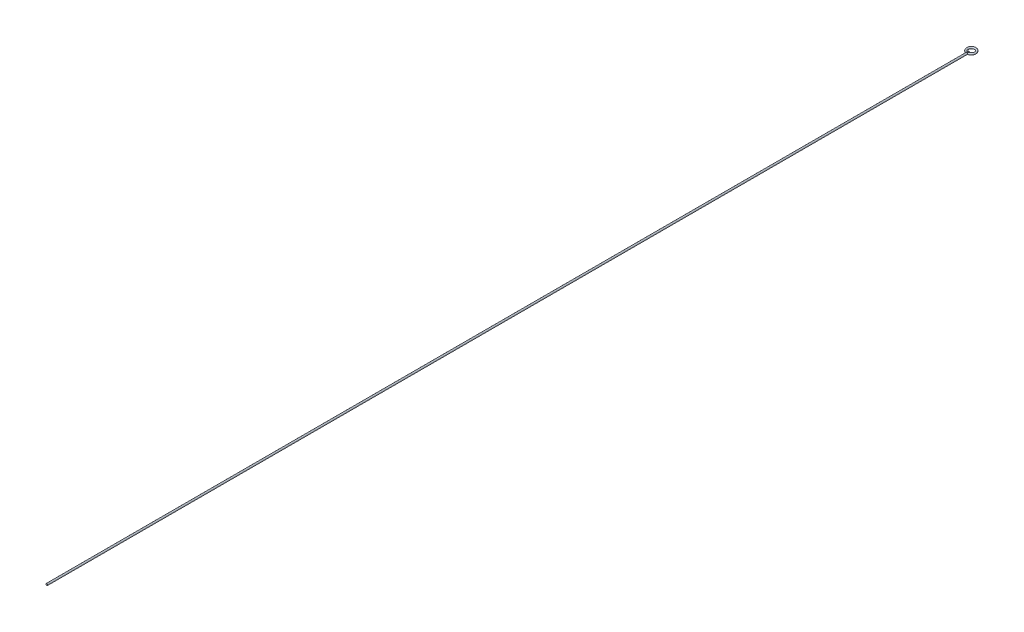
from build123d import *

# Parameters (mm, degrees)
BOSS_EXTRUDE1_START = 6
SKETCH1_R           = 2
BOSS_EXTRUDE1_DEPTH = 2150
SKETCH4_R           = 2
SKETCH7_R           = 2
BOSS_EXTRUDE2_DEPTH = 2.1


with BuildPart() as part:
    # Sketch1 → Boss-Extrude1 (new body)
    with BuildSketch(Plane.XY.offset(BOSS_EXTRUDE1_START)):
        Circle(SKETCH1_R)
    extrude(amount=BOSS_EXTRUDE1_DEPTH)

    # Sketch4 → Revolve1 (revolve)
    with BuildSketch(Plane(origin=(0, 0, 0), x_dir=(-1, 0, 0), z_dir=(0, 0, -1)), mode=Mode.PRIVATE) as revolve1_sk:
        with Locations((-9, 0)):
            Circle(SKETCH4_R)
    revolve(revolve1_sk.sketch.rotate(Axis((0, 3.776003841, 0), (0, -1, 0)), 269.999990329), axis=Axis((0, 3.776003841, 0), (0, -1, 0)))

    # Sketch7 → Boss-Extrude2 (add)
    with BuildSketch(Plane(origin=(0, 0, 0), x_dir=(1, 0, 0), z_dir=(0, 1, 0))):
        with Locations(Location((0, -9, 0), (0, 0, 132.556740857))):
            Circle(SKETCH7_R)
    extrude(amount=BOSS_EXTRUDE2_DEPTH)


solid = part.part
